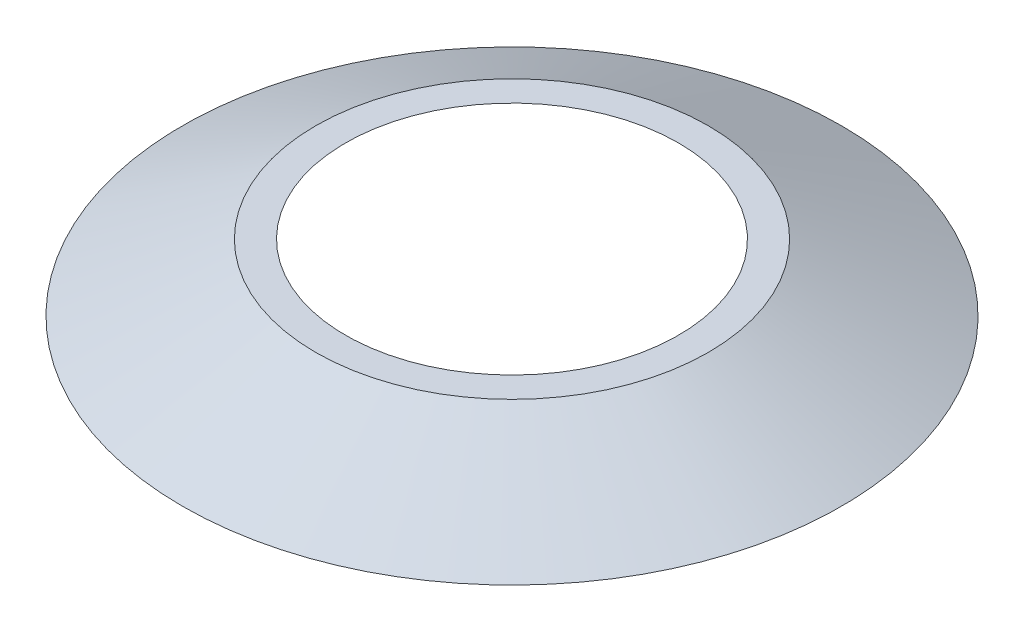
from build123d import *


with BuildPart() as part:
    # Çizim1 → Döndür1 (revolve)
    with BuildSketch(Plane.XY, mode=Mode.PRIVATE) as d_nd_r1_sk:
        Polygon((-4.5, 0), (-2.5, 1), (-2.947213595, 1), (-4.947213595, 0), align=None)
    revolve(d_nd_r1_sk.sketch.rotate(Axis((0, 0, 0), (0, 1, 0)), 270), axis=Axis((0, 0, 0), (0, 1, 0)))


solid = part.part
